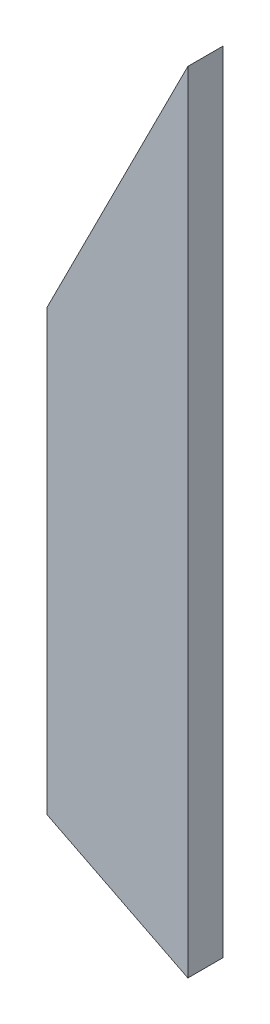
from build123d import *

# Parameters (mm, degrees)
BOSS_EXTRUDE1_DEPTH = 12.7


with BuildPart() as part:
    # Sketch1 → Boss-Extrude1 (new body)
    with BuildSketch(Plane.XY):
        Polygon((25.4, -142.24), (25.4, 142.24), (-25.4, 41.553426039), (-25.4, -116.617454927), align=None)
    extrude(amount=BOSS_EXTRUDE1_DEPTH)


solid = part.part
